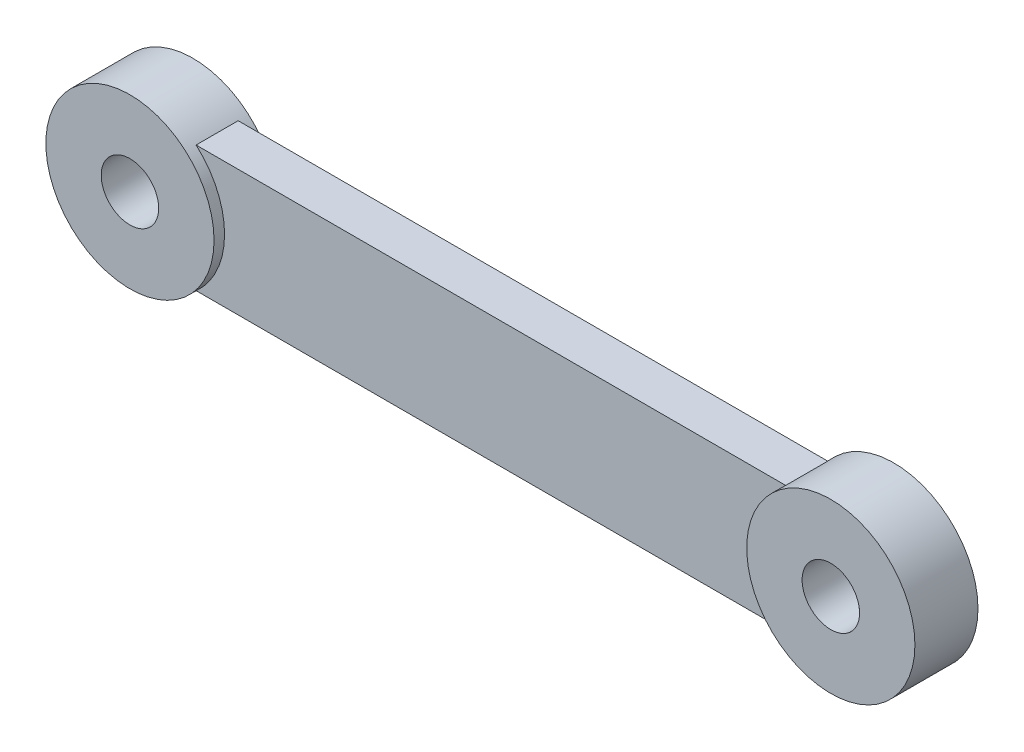
from build123d import *

# Parameters (mm, degrees)
EXTRUDE_1_DEPTH      = 3
EXTRUDE_1_DEPTH_BACK = 3
SKETCH_1_4_R         = 12
SKETCH_1_4_R_2       = 4.1
EXTRUDE_2_DEPTH      = 4.5


with BuildPart() as part:
    # 草图1 → 凸台-拉伸1 (new, two sides: drawn at the far end of the back side and taken through both)
    with BuildSketch(Plane.XY.offset(-EXTRUDE_1_DEPTH_BACK)):
        with BuildLine():
            Line((42.062746067, 9), (-42.062746067, 9))
            ThreePointArc((-42.062746067, 9), (-39.062746067, 4.937253933), (-38, 0))
            ThreePointArc((-38, 0), (-39.062746067, -4.937253933), (-42.062746067, -9))
            Line((-42.062746067, -9), (42.062746067, -9))
            ThreePointArc((42.062746067, -9), (38, 0), (42.062746067, 9))
        make_face()
    extrude(amount=EXTRUDE_1_DEPTH + EXTRUDE_1_DEPTH_BACK)

    # 草图1<4> → 凸台-拉伸2 (add, symmetric)
    # profile 1 of 2: a face of its own
    with BuildSketch(Plane.XY):
        with Locations((-50, 0)):
            Circle(SKETCH_1_4_R)
        with Locations((-50, 0)):
            Circle(SKETCH_1_4_R_2, mode=Mode.SUBTRACT)
    # profile 2 of 2: a face of its own
    with BuildSketch(Plane.XY):
        with Locations((50, 0)):
            Circle(SKETCH_1_4_R)
        with Locations((50, 0)):
            Circle(SKETCH_1_4_R_2, mode=Mode.SUBTRACT)
    extrude(amount=EXTRUDE_2_DEPTH, both=True)


solid = part.part
